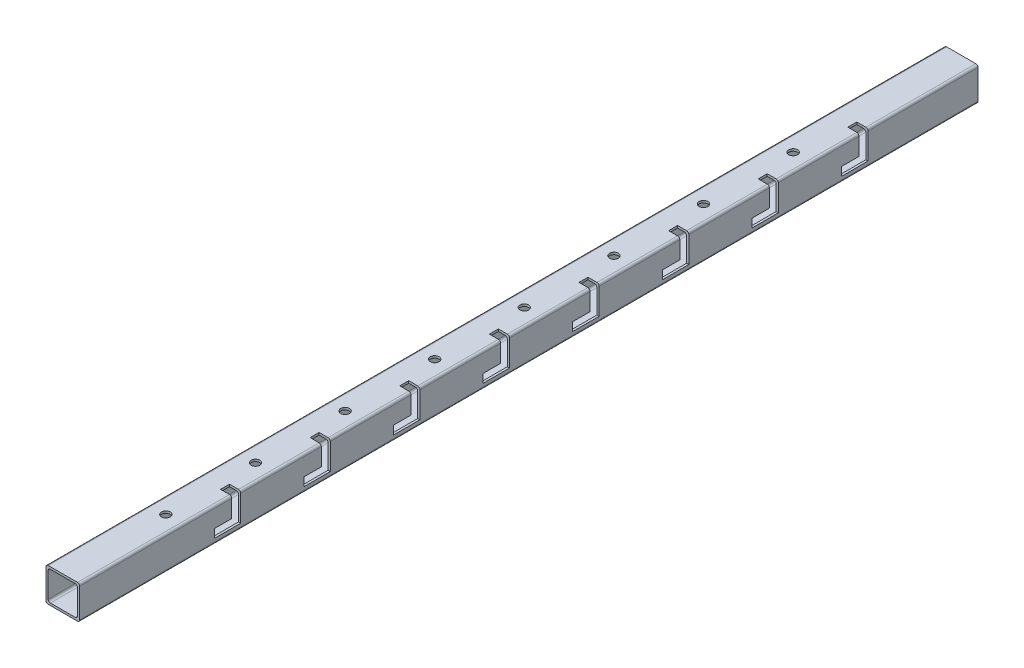
from build123d import *

# Parameters (mm, degrees)
SKETCH3_W           = 19.05
SKETCH3_H           = 19.05
SKETCH3_W_2         = 16.5608
SKETCH3_H_2         = 16.5608
BOSS_EXTRUDE1_DEPTH = 254.635
FILLET1_R           = 1.2446
SKETCH4_R           = 2.4892
CUT_EXTRUDE1_DEPTH  = 256.524189364
CUT_EXTRUDE3_START  = -19.05
CUT_EXTRUDE3_DEPTH  = 6.35
LPATTERN2_COUNT     = 8
LPATTERN2_PITCH     = 50.8


with BuildPart() as part:
    # Sketch3 → Boss-Extrude1 (new, symmetric)
    with BuildSketch(Plane.XY):
        Rectangle(SKETCH3_W, SKETCH3_H)
        Rectangle(SKETCH3_W_2, SKETCH3_H_2, mode=Mode.SUBTRACT)
    extrude(amount=BOSS_EXTRUDE1_DEPTH, both=True)

    # Fillet1
    fillet1_edges = [part.edges().sort_by_distance(p)[0] for p in [
        (-8.2804, -8.2804, 0),
        (8.2804, -8.2804, 0),
        (8.2804, 8.2804, 0),
        (-8.2804, 8.2804, 0),
        (9.525, -9.525, 0),
        (-9.525, -9.525, 0),
        (-9.525, 9.525, 0),
        (9.525, 9.525, 0),
    ]]
    fillet(fillet1_edges, radius=FILLET1_R)

    # Sketch4 → Cut-Extrude1 (cut, through all)
    with BuildSketch(Plane(origin=(0, 9.525, 0), x_dir=(1, 0, 0), z_dir=(0, 1, 0))):
        with Locations(Location((0, 159.385, 0), (0, 0, 270))):
            Circle(SKETCH4_R)
        with Locations(Location((0, 108.585, 0), (0, 0, 270))):
            Circle(SKETCH4_R)
        with Locations(Location((0, 57.785, 0), (0, 0, 270))):
            Circle(SKETCH4_R)
        with Locations(Location((0, 6.985, 0), (0, 0, 270))):
            Circle(SKETCH4_R)
        with Locations(Location((0, -43.815, 0), (0, 0, 270))):
            Circle(SKETCH4_R)
        with Locations(Location((0, -94.615, 0), (0, 0, 270))):
            Circle(SKETCH4_R)
        with Locations(Location((0, -145.415, 0), (0, 0, 270))):
            Circle(SKETCH4_R)
        with Locations(Location((0, -196.215, 0), (0, 0, 270))):
            Circle(SKETCH4_R)
    extrude(amount=-CUT_EXTRUDE1_DEPTH, mode=Mode.SUBTRACT)

    # Sketch6 → Cut-Extrude3 (cut)
    with BuildSketch(Plane.ZY.offset(9.525).offset(CUT_EXTRUDE3_START)):
        Polygon((-182.118, -1.651), (-187.198, -1.651), (-187.198, 9.525), (-192.278, 9.525), (-192.278, -6.477), (-182.118, -6.477), (-177.292, -6.477), (-177.292, -1.651), align=None)
    cut_extrude3 = extrude(amount=CUT_EXTRUDE3_DEPTH, mode=Mode.SUBTRACT)

    # LPattern2: Cut-Extrude3 ×8
    with Locations(*[(0, 0, i * LPATTERN2_PITCH) for i in range(1, LPATTERN2_COUNT)]):
        add(cut_extrude3, mode=Mode.SUBTRACT)


solid = part.part
